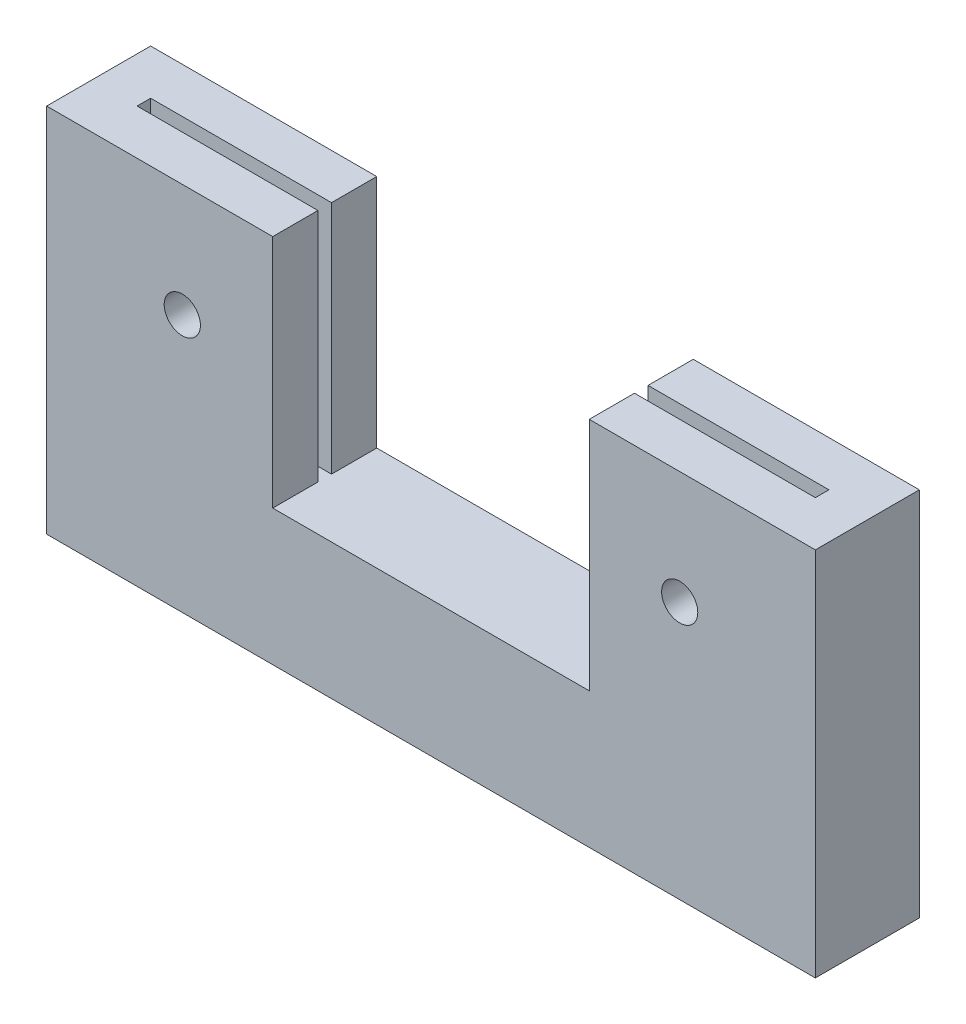
from build123d import *

# Parameters (mm, degrees)
SKETCH2_W           = 85
SKETCH2_H           = 11.5
BOSS_EXTRUDE1_DEPTH = 15
SKETCH3_R           = 2.75
CUT_EXTRUDE1_DEPTH  = 10
BOSS_EXTRUDE2_DEPTH = 26
SKETCH5_R           = 2
CUT_EXTRUDE2_DEPTH  = 5


with BuildPart() as part:
    # Sketch2 → Boss-Extrude1 (new body)
    with BuildSketch(Plane(origin=(0, 0, 0), x_dir=(1, 0, 0), z_dir=(0, 1, 0))):
        Rectangle(SKETCH2_W, SKETCH2_H)
    extrude(amount=BOSS_EXTRUDE1_DEPTH)

    # Sketch3 → Cut-Extrude1 (cut)
    with BuildSketch(Plane.XZ):
        with Locations(Location((0, 0, 0), (0, 0, 270))):
            Circle(SKETCH3_R)
    extrude(amount=-CUT_EXTRUDE1_DEPTH, mode=Mode.SUBTRACT)

    # Sketch4 → Boss-Extrude2 (add)
    with BuildSketch(Plane(origin=(0, 15, 0), x_dir=(1, 0, 0), z_dir=(0, 1, 0))):
        Polygon((-42.5, 5.75), (-17.5, 5.75), (-17.5, 0.75), (-37.5, 0.75), (-37.5, -0.75), (-17.5, -0.75), (-17.5, -5.75), (-42.5, -5.75), align=None)
        Polygon((42.5, 5.75), (42.5, -5.75), (17.5, -5.75), (17.5, -0.75), (37.5, -0.75), (37.5, 0.75), (17.5, 0.75), (17.5, 5.75), align=None)
    extrude(amount=BOSS_EXTRUDE2_DEPTH)

    # Sketch5 → Cut-Extrude2 (cut)
    with BuildSketch(Plane.XY.offset(5.75)):
        with Locations((-27.5, 28.5)):
            Circle(SKETCH5_R)
        with Locations((27.5, 28.5)):
            Circle(SKETCH5_R)
    extrude(amount=-CUT_EXTRUDE2_DEPTH, mode=Mode.SUBTRACT)


solid = part.part
